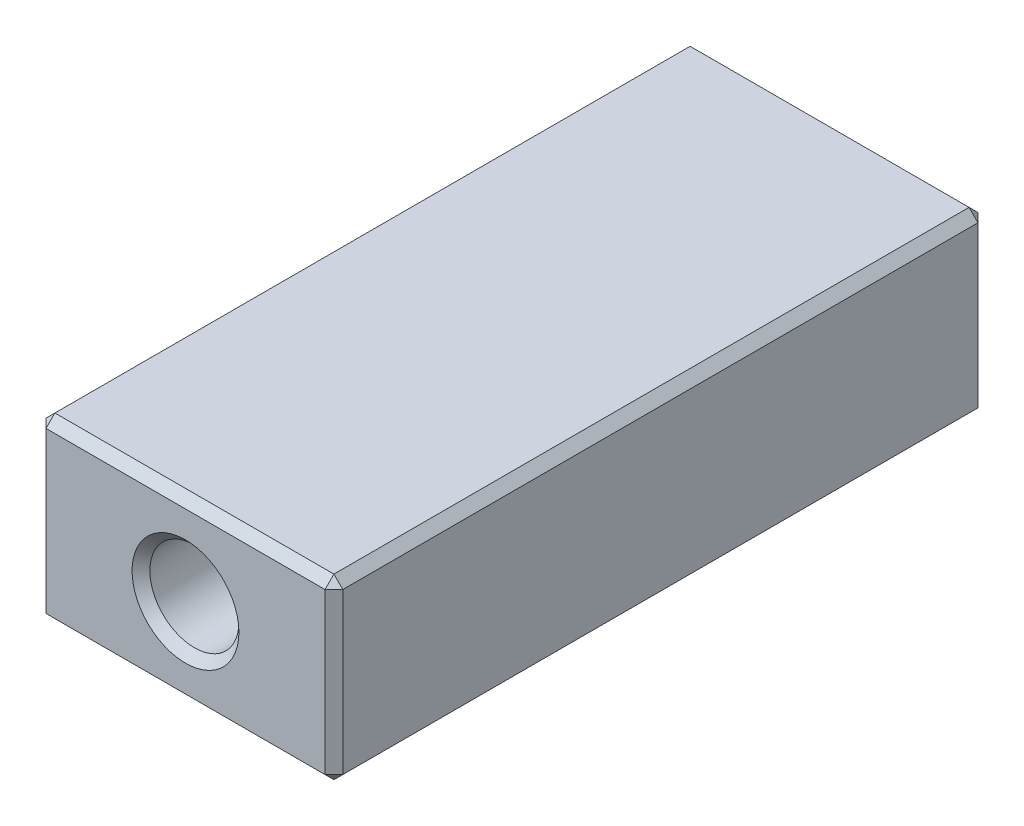
from build123d import *

# Parameters (mm, degrees)
SKETCH_1_W          = 10
SKETCH_1_H          = 6
EXTRUDE_1_DEPTH     = 22
SKETCH_3_R          = 1.5
CUT_EXTRUDE_1_DEPTH = 23.759613353
CHAMFER_1_SIZE      = 0.3


with BuildPart() as part:
    # 草图1 → 凸台-拉伸1 (new body)
    with BuildSketch(Plane.XY):
        Rectangle(SKETCH_1_W, SKETCH_1_H)
    extrude(amount=EXTRUDE_1_DEPTH)

    # 草图3 → 切除-拉伸1 (cut, through all)
    with BuildSketch(Plane(origin=(0, 0, 0), x_dir=(-1, 0, 0), z_dir=(0, 0, -1))):
        Circle(SKETCH_3_R)
    extrude(amount=-CUT_EXTRUDE_1_DEPTH, mode=Mode.SUBTRACT)

    # 倒角1
    chamfer_1_edges = [part.edges().sort_by_distance(p)[0] for p in [
        (-5, 0, 22),
        (1.5, 0, 22),
        (1.5, 0, 0),
        (0, -3, 22),
        (5, 0, 22),
        (0, -3, 0),
        (-5, 0, 0),
        (0, 3, 0),
        (5, 0, 0),
        (5, -3, 11),
        (-5, -3, 11),
        (-5, 3, 11),
        (5, 3, 11),
        (0, 3, 22),
    ]]
    chamfer(chamfer_1_edges, length=CHAMFER_1_SIZE)


solid = part.part
